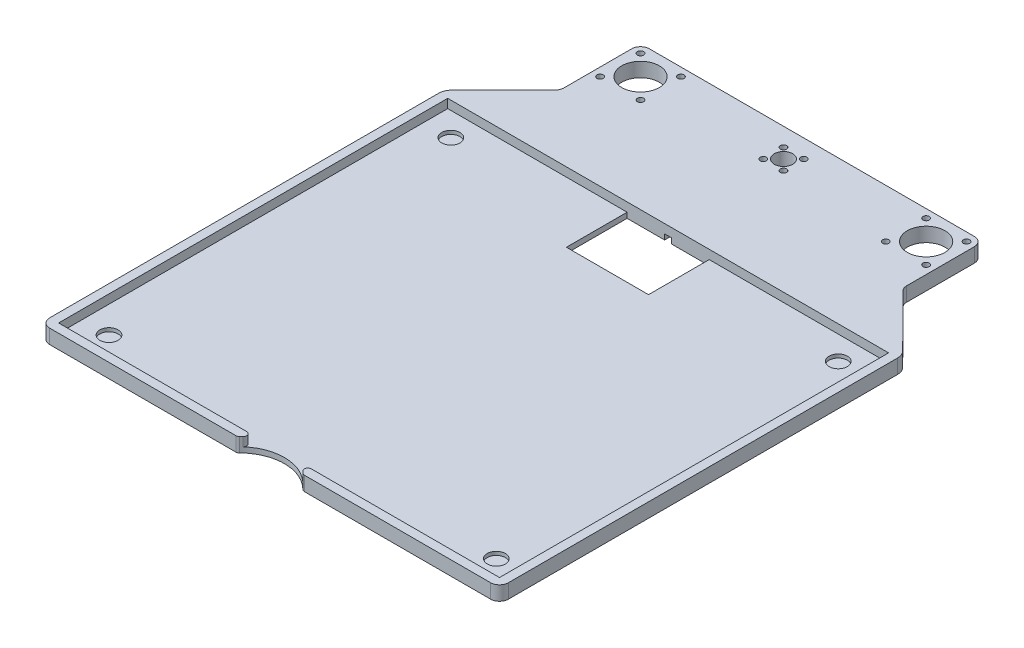
from build123d import *
from OCP.BRepFilletAPI import BRepFilletAPI_MakeFillet

# Parameters (mm, degrees)
SALIENTE_EXTRUIR1_DEPTH = 8
REDONDEO1_R1            = 7
REDONDEO1_R2            = 5
REDONDEO1_R3            = 5
CROQUIS17_R             = 5.15
CROQUIS17_R_2           = 1.75
CORTAR_EXTRUIR15_DEPTH  = 316.011904537
CROQUIS18_R             = 1.75
CORTAR_EXTRUIR16_DEPTH  = 316.011904537
CROQUIS19_R             = 1.75
CORTAR_EXTRUIR17_DEPTH  = 316.011904537
CROQUIS20_R             = 1.75
CORTAR_EXTRUIR18_DEPTH  = 316.011904537
CROQUIS21_R             = 1.75
CORTAR_EXTRUIR19_DEPTH  = 316.011904537
CROQUIS22_R             = 10.55
CORTAR_EXTRUIR20_DEPTH  = 316.011904537
CROQUIS23_R             = 1.75
CORTAR_EXTRUIR21_DEPTH  = 316.011904537
CROQUIS24_R             = 1.75
CORTAR_EXTRUIR22_DEPTH  = 316.011904537
CROQUIS25_R             = 1.75
CORTAR_EXTRUIR23_DEPTH  = 316.011904537
CROQUIS26_R             = 1.75
CORTAR_EXTRUIR24_DEPTH  = 316.011904537
CROQUIS27_R             = 10.55
CORTAR_EXTRUIR25_DEPTH  = 316.011904537
CROQUIS31_W             = 247
CROQUIS31_H             = 217.984697531
CORTAR_EXTRUIR29_DEPTH  = 5
CROQUIS32_R             = 5.1
CORTAR_EXTRUIR30_DEPTH  = 2
CORTAR_EXTRUIR31_DEPTH  = 3
CORTAR_EXTRUIR32_REACH  = 317.012
CROQUIS34_R             = 25
REDONDEO4_R             = 2


with BuildPart() as part:
    # Croquis1 → Saliente-Extruir1 (new body)
    with BuildSketch(Plane(origin=(0, 4, 0), x_dir=(1, 0, 0), z_dir=(0, 1, 0))):
        Polygon((96, 16), (-96, 16), (-96, -29), (-128.5, -61.623586062), (-128.5, -287.5), (128.5, -287.5), (128.5, -61.623586062), (96, -29), align=None)
    extrude(amount=-SALIENTE_EXTRUIR1_DEPTH)

    # Redondeo1: one fillet with a radius per group of edges: ONE call of the kernel's fillet builder (fillet() takes one radius for all edges)
    redondeo1_edges_1 = [part.edges().sort_by_distance(p)[0] for p in [
        (-128.5, 0, 61.623586062),
        (128.5, 0, 61.623586062),
    ]]
    redondeo1_edges_2 = [part.edges().sort_by_distance(p)[0] for p in [
        (96, 0, -16),
        (-96, 0, 29),
        (-96, 0, -16),
        (96, 0, 29),
    ]]
    redondeo1_edges_3 = [part.edges().sort_by_distance(p)[0] for p in [
        (128.5, 0, 287.5),
        (-128.5, 0, 287.5),
    ]]
    redondeo1 = BRepFilletAPI_MakeFillet(part.part.solid().wrapped)
    for e in redondeo1_edges_1:
        redondeo1.Add(REDONDEO1_R1, e.wrapped)
    for e in redondeo1_edges_2:
        redondeo1.Add(REDONDEO1_R2, e.wrapped)
    for e in redondeo1_edges_3:
        redondeo1.Add(REDONDEO1_R3, e.wrapped)
    add(Compound.cast(redondeo1.Shape()), mode=Mode.REPLACE)

    # Croquis17 → Cortar-Extruir15 (cut, through all)
    with BuildSketch(Plane.XZ.offset(4)):
        with Locations((0, -0.1)):
            Circle(CROQUIS17_R)
        with Locations((-5.656854249, -5.756854249)):
            Circle(CROQUIS17_R_2)
        with Locations((5.656854249, -5.756854249)):
            Circle(CROQUIS17_R_2)
        with Locations((5.656854249, 5.556854249)):
            Circle(CROQUIS17_R_2)
        with Locations((-5.656854249, 5.556854249)):
            Circle(CROQUIS17_R_2)
    extrude(amount=-CORTAR_EXTRUIR15_DEPTH, mode=Mode.SUBTRACT)

    # Croquis18 → Cortar-Extruir16 (cut, through all)
    with BuildSketch(Plane.XZ.offset(4)):
        with Locations((91.313708499, 11.313708499)):
            Circle(CROQUIS18_R)
    extrude(amount=-CORTAR_EXTRUIR16_DEPTH, mode=Mode.SUBTRACT)

    # Croquis19 → Cortar-Extruir17 (cut, through all)
    with BuildSketch(Plane.XZ.offset(4)):
        with Locations((91.313708499, -11.313708499)):
            Circle(CROQUIS19_R)
    extrude(amount=-CORTAR_EXTRUIR17_DEPTH, mode=Mode.SUBTRACT)

    # Croquis20 → Cortar-Extruir18 (cut, through all)
    with BuildSketch(Plane.XZ.offset(4)):
        with Locations((68.686291501, 11.313708499)):
            Circle(CROQUIS20_R)
    extrude(amount=-CORTAR_EXTRUIR18_DEPTH, mode=Mode.SUBTRACT)

    # Croquis21 → Cortar-Extruir19 (cut, through all)
    with BuildSketch(Plane.XZ.offset(4)):
        with Locations((68.686291501, -11.313708499)):
            Circle(CROQUIS21_R)
    extrude(amount=-CORTAR_EXTRUIR19_DEPTH, mode=Mode.SUBTRACT)

    # Croquis22 → Cortar-Extruir20 (cut, through all)
    with BuildSketch(Plane.XZ.offset(4)):
        with Locations((80, 0)):
            Circle(CROQUIS22_R)
    extrude(amount=-CORTAR_EXTRUIR20_DEPTH, mode=Mode.SUBTRACT)

    # Croquis23 → Cortar-Extruir21 (cut, through all)
    with BuildSketch(Plane.XZ.offset(4)):
        with Locations((-68.686291501, -11.313708499)):
            Circle(CROQUIS23_R)
    extrude(amount=-CORTAR_EXTRUIR21_DEPTH, mode=Mode.SUBTRACT)

    # Croquis24 → Cortar-Extruir22 (cut, through all)
    with BuildSketch(Plane.XZ.offset(4)):
        with Locations((-68.686291501, 11.313708499)):
            Circle(CROQUIS24_R)
    extrude(amount=-CORTAR_EXTRUIR22_DEPTH, mode=Mode.SUBTRACT)

    # Croquis25 → Cortar-Extruir23 (cut, through all)
    with BuildSketch(Plane.XZ.offset(4)):
        with Locations((-91.313708499, 11.313708499)):
            Circle(CROQUIS25_R)
    extrude(amount=-CORTAR_EXTRUIR23_DEPTH, mode=Mode.SUBTRACT)

    # Croquis26 → Cortar-Extruir24 (cut, through all)
    with BuildSketch(Plane.XZ.offset(4)):
        with Locations((-91.313708499, -11.313708499)):
            Circle(CROQUIS26_R)
    extrude(amount=-CORTAR_EXTRUIR24_DEPTH, mode=Mode.SUBTRACT)

    # Croquis27 → Cortar-Extruir25 (cut, through all)
    with BuildSketch(Plane.XZ.offset(4)):
        with Locations((-80, 0)):
            Circle(CROQUIS27_R)
    extrude(amount=-CORTAR_EXTRUIR25_DEPTH, mode=Mode.SUBTRACT)

    # Croquis31 → Cortar-Extruir29 (cut)
    with BuildSketch(Plane(origin=(0, 4, 0), x_dir=(1, 0, 0), z_dir=(0, 1, 0))):
        with Locations((0, -173.507651235)):
            Rectangle(CROQUIS31_W, CROQUIS31_H)
    extrude(amount=-CORTAR_EXTRUIR29_DEPTH, mode=Mode.SUBTRACT)

    # Croquis32 → Cortar-Extruir30 (cut)
    with BuildSketch(Plane(origin=(0, -1, 0), x_dir=(1, 0, 0), z_dir=(0, 1, 0))):
        with Locations((-108.504553774, -77.749220728)):
            Circle(CROQUIS32_R)
        with Locations((-108.504553774, -269.266081741)):
            Circle(CROQUIS32_R)
        with Locations((108.504553774, -269.266081741)):
            Circle(CROQUIS32_R)
        with Locations((108.504553774, -77.749220728)):
            Circle(CROQUIS32_R)
    extrude(amount=-CORTAR_EXTRUIR30_DEPTH, mode=Mode.SUBTRACT)

    # Croquis33 → Cortar-Extruir31 (cut)
    with BuildSketch(Plane(origin=(0, -1, 0), x_dir=(1, 0, 0), z_dir=(0, 1, 0))):
        with BuildLine():
            Line((-23, -98.515302469), (23, -98.515302469))
            Line((23, -98.515302469), (23, -64.515302469))
            Line((23, -64.515302469), (2, -64.515302469))
            Line((2, -64.515302469), (2, -54.515302469))
            ThreePointArc((2, -54.515302469), (7.272077939, -41.787380408), (20, -36.515302469))
            Line((20, -36.515302469), (103.48683268, -36.515302469))
            Line((103.48683268, -36.515302469), (99.50198565, -32.515302469))
            Line((99.50198565, -32.515302469), (20, -32.515302469))
            ThreePointArc((20, -32.515302469), (4.443650814, -38.958953283), (-2, -54.515302469))
            Line((-2, -54.515302469), (-2, -64.515302469))
            Line((-2, -64.515302469), (-23, -64.515302469))
            Line((-23, -64.515302469), (-23, -98.515302469))
        make_face()
    extrude(amount=-CORTAR_EXTRUIR31_DEPTH, mode=Mode.SUBTRACT)

    # Croquis34 → Cortar-Extruir32 (cut, up to next)
    with BuildSketch(Plane(origin=(0, 4, 0), x_dir=(1, 0, 0), z_dir=(0, 1, 0)), mode=Mode.PRIVATE) as cortar_extruir32_sk1:
        with Locations((0, -304.5)):
            Circle(CROQUIS34_R)
    cortar_extruir32_tool1 = extrude(cortar_extruir32_sk1.sketch, amount=-CORTAR_EXTRUIR32_REACH, mode=Mode.PRIVATE) & part.part
    add(cortar_extruir32_tool1.solids().sort_by_distance((0, 4, 304.5))[0], mode=Mode.SUBTRACT)

    # Redondeo4
    redondeo4_edges = [part.edges().sort_by_distance(p)[0] for p in [
        (18.33030278, 0, 287.5),
        (-18.33030278, 0, 287.5),
        (11.874342087, 1.5, 282.5),
        (-11.874342087, 1.5, 282.5),
    ]]
    fillet(redondeo4_edges, radius=REDONDEO4_R)


solid = part.part
